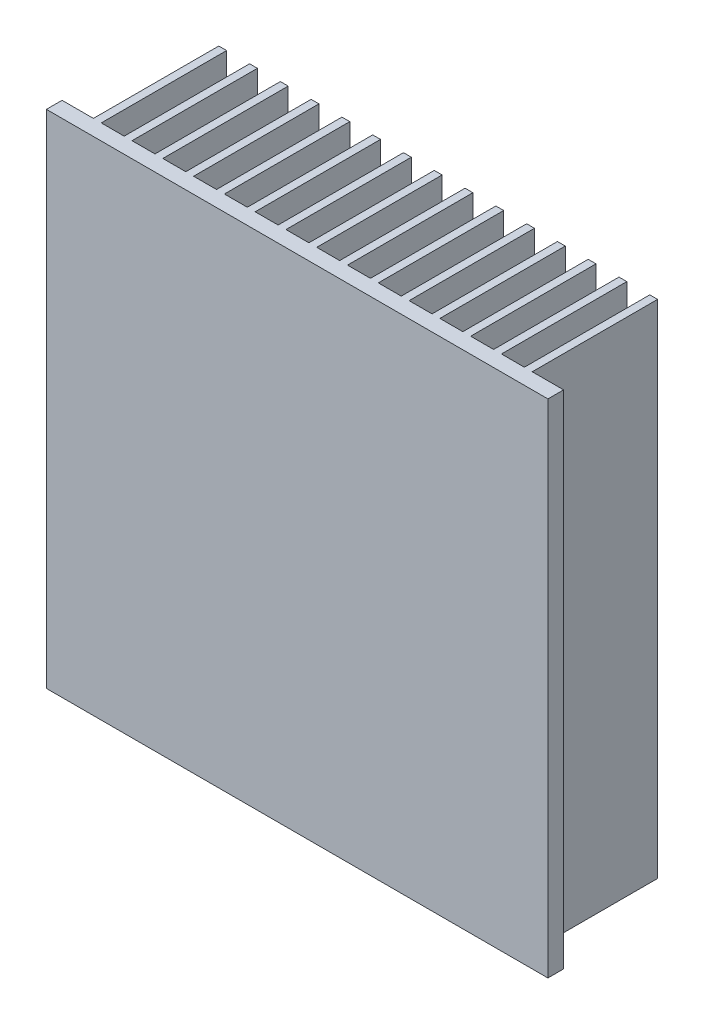
from build123d import *

# Parameters (mm, degrees)
BOSS_EXTRUDE1_DEPTH = 101.6


with BuildPart() as part:
    # Sketch1 → Boss-Extrude1 (new body)
    with BuildSketch(Plane(origin=(0, 0, 0), x_dir=(1, 0, 0), z_dir=(0, 1, 0))):
        Polygon((-38.213392857, 3.175), (-38.213392857, 28.575), (-36.625892857, 28.575), (-36.625892857, 3.175), (-31.976785714, 3.175), (-31.976785714, 28.575), (-30.389285714, 28.575), (-30.389285714, 3.175), (-25.740178571, 3.175), (-25.740178571, 28.575), (-24.152678571, 28.575), (-24.152678571, 3.175), (-19.503571429, 3.175), (-19.503571429, 28.575), (-17.916071429, 28.575), (-17.916071429, 3.175), (-13.266964286, 3.175), (-13.266964286, 28.575), (-11.679464286, 28.575), (-11.679464286, 3.175), (-7.030357143, 3.175), (-7.030357143, 28.575), (-5.442857143, 28.575), (-5.442857143, 3.175), (-0.79375, 3.175), (-0.79375, 28.575), (0.79375, 28.575), (0.79375, 3.175), (5.442857143, 3.175), (5.442857143, 28.575), (7.030357143, 28.575), (7.030357143, 3.175), (11.679464286, 3.175), (11.679464286, 28.575), (13.266964286, 28.575), (13.266964286, 3.175), (17.916071429, 3.175), (17.916071429, 28.575), (19.503571429, 28.575), (19.503571429, 3.175), (24.152678571, 3.175), (24.152678571, 28.575), (25.740178571, 28.575), (25.740178571, 3.175), (30.389285714, 3.175), (30.389285714, 28.575), (31.976785714, 28.575), (31.976785714, 3.175), (36.625892857, 3.175), (36.625892857, 28.575), (38.213392857, 28.575), (38.213392857, 3.175), (42.8625, 3.175), (42.8625, 28.575), (44.45, 28.575), (44.45, 3.175), (50.8, 3.175), (50.8, 0), (-50.8, 0), (-50.8, 3.175), (-44.45, 3.175), (-44.45, 28.575), (-42.8625, 28.575), (-42.8625, 3.175), align=None)
    extrude(amount=BOSS_EXTRUDE1_DEPTH)


solid = part.part
